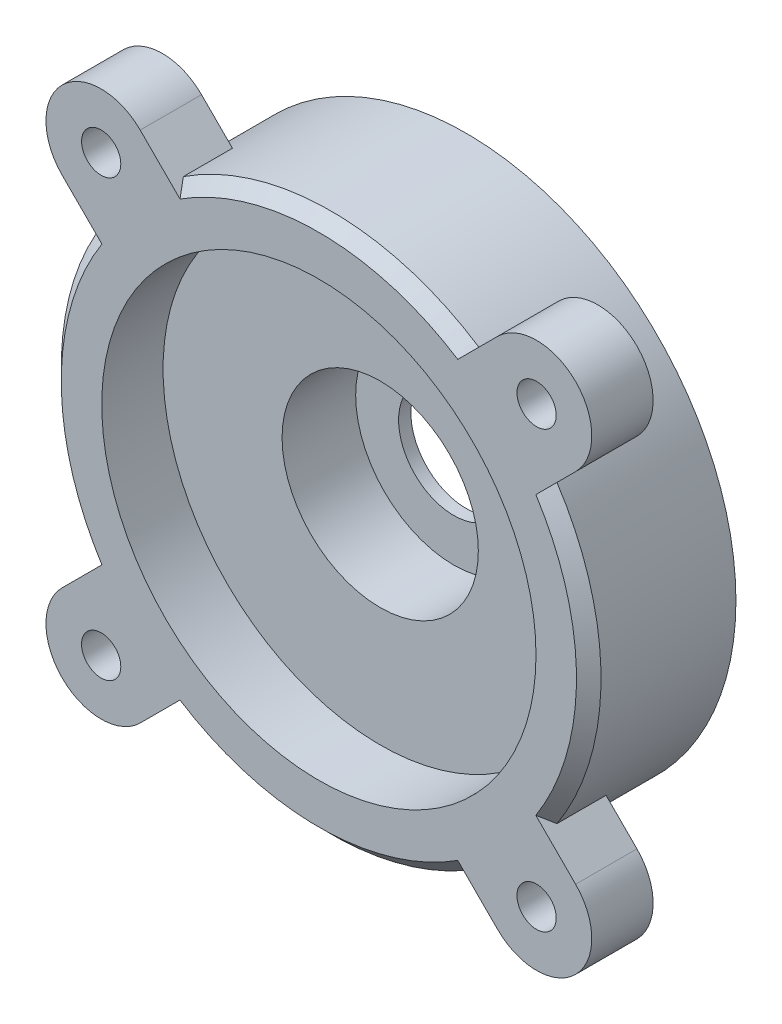
from build123d import *

# Parameters (mm, degrees)
SKETCH1_R           = 22
BOSS_EXTRUDE1_DEPTH = 6
CHAMFER1_SIZE       = 1
SKETCH8_R           = 1.6
BOSS_EXTRUDE2_DEPTH = 5
SKETCH9_R           = 17.7
CUT_EXTRUDE1_DEPTH  = 5
SKETCH10_R          = 8
CUT_EXTRUDE2_DEPTH  = 6
SKETCH11_R          = 4.5
CUT_EXTRUDE3_DEPTH  = 1


with BuildPart() as part:
    # Sketch1 → Boss-Extrude1 (new, symmetric)
    with BuildSketch(Plane.XY):
        Circle(SKETCH1_R)
    extrude(amount=BOSS_EXTRUDE1_DEPTH, both=True)

    # Chamfer1
    chamfer1_edges = [part.edges().sort_by_distance(p)[0] for p in [
        (-22, 0, 6),
    ]]
    chamfer(chamfer1_edges, length=CHAMFER1_SIZE)

    # Sketch8 → Boss-Extrude2 (add)
    # profile 1 of 4: a face of its own
    with BuildSketch(Plane.XY.offset(6)):
        with BuildLine():
            Line((20.930360723, -14.566399692), (17.68629022, -11.322329189))
            Line((17.68629022, -11.322329189), (11.322329189, -17.68629022))
            Line((11.322329189, -17.68629022), (14.566399692, -20.930360723))
            ThreePointArc((14.566399692, -20.930360723), (20.930360723, -20.930360723), (20.930360723, -14.566399692))
        make_face()
        with Locations((17.748380208, -17.748380208)):
            Circle(SKETCH8_R, mode=Mode.SUBTRACT)
    # profile 2 of 4: a face of its own
    with BuildSketch(Plane.XY.offset(6)):
        with BuildLine():
            Line((14.566399692, 20.930360723), (11.322329189, 17.68629022))
            Line((11.322329189, 17.68629022), (17.68629022, 11.322329189))
            Line((17.68629022, 11.322329189), (20.930360723, 14.566399692))
            ThreePointArc((20.930360723, 14.566399692), (20.930360723, 20.930360723), (14.566399692, 20.930360723))
        make_face()
        with Locations((17.748380208, 17.748380208)):
            Circle(SKETCH8_R, mode=Mode.SUBTRACT)
    # profile 3 of 4: a face of its own
    with BuildSketch(Plane.XY.offset(6)):
        with BuildLine():
            Line((-14.566399692, -20.930360723), (-11.322329189, -17.68629022))
            Line((-11.322329189, -17.68629022), (-17.68629022, -11.322329189))
            Line((-17.68629022, -11.322329189), (-20.930360723, -14.566399692))
            ThreePointArc((-20.930360723, -14.566399692), (-20.930360723, -20.930360723), (-14.566399692, -20.930360723))
        make_face()
        with Locations((-17.748380208, -17.748380208)):
            Circle(SKETCH8_R, mode=Mode.SUBTRACT)
    # profile 4 of 4: a face of its own
    with BuildSketch(Plane.XY.offset(6)):
        with BuildLine():
            Line((-20.930360723, 14.566399692), (-17.68629022, 11.322329189))
            Line((-17.68629022, 11.322329189), (-11.322329189, 17.68629022))
            Line((-11.322329189, 17.68629022), (-14.566399692, 20.930360723))
            ThreePointArc((-14.566399692, 20.930360723), (-20.930360723, 20.930360723), (-20.930360723, 14.566399692))
        make_face()
        with Locations((-17.748380208, 17.748380208)):
            Circle(SKETCH8_R, mode=Mode.SUBTRACT)
    extrude(amount=-BOSS_EXTRUDE2_DEPTH)

    # Sketch9 → Cut-Extrude1 (cut)
    with BuildSketch(Plane.XY.offset(6)):
        Circle(SKETCH9_R)
    extrude(amount=-CUT_EXTRUDE1_DEPTH, mode=Mode.SUBTRACT)

    # Sketch10 → Cut-Extrude2 (cut)
    with BuildSketch(Plane.XY.offset(1)):
        Circle(SKETCH10_R)
    extrude(amount=-CUT_EXTRUDE2_DEPTH, mode=Mode.SUBTRACT)

    # Sketch11 → Cut-Extrude3 (cut)
    with BuildSketch(Plane.XY.offset(-5)):
        Circle(SKETCH11_R)
    extrude(amount=-CUT_EXTRUDE3_DEPTH, mode=Mode.SUBTRACT)


solid = part.part
